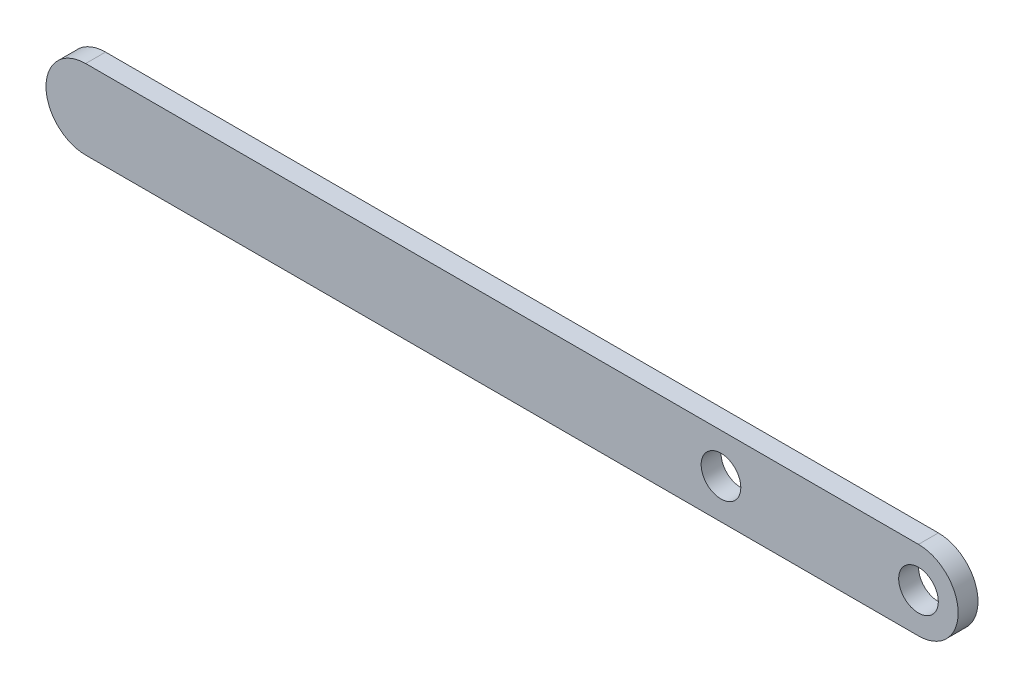
from build123d import *

# Parameters (mm, degrees)
SKETCH1_R           = 2.49690856
BOSS_EXTRUDE1_DEPTH = 2.5


with BuildPart() as part:
    # Sketch1 → Boss-Extrude1 (new body)
    with BuildSketch(Plane.XY):
        with BuildLine():
            Line((-54.387351779, 4.99381712), (50.48280775, 4.99381712))
            ThreePointArc((50.48280775, 4.99381712), (55.476624871, 0), (50.48280775, -4.99381712))
            Line((50.48280775, -4.99381712), (-54.387351779, -4.99381712))
            ThreePointArc((-54.387351779, -4.99381712), (-59.381168899, 0), (-54.387351779, 4.99381712))
        make_face()
        with Locations((50.48280775, 0)):
            Circle(SKETCH1_R, mode=Mode.SUBTRACT)
        with Locations((25.612648221, 0)):
            Circle(SKETCH1_R, mode=Mode.SUBTRACT)
    extrude(amount=BOSS_EXTRUDE1_DEPTH)


solid = part.part
